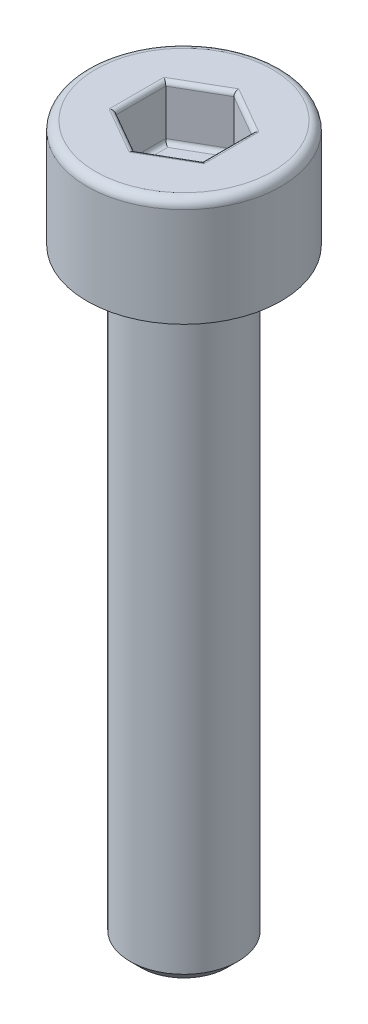
from build123d import *

# Parameters (mm, degrees)
CHAMFER1_SIZE      = 0.25
FILLET1_R          = 0.2
CUT_EXTRUDE1_DEPTH = 1.25
FILLET2_R          = 0.1


with BuildPart() as part:
    # Sketch1 → Revolve1 (revolve)
    with BuildSketch(Plane.XY, mode=Mode.PRIVATE) as revolve1_sk:
        Polygon((0, -16.5), (-1.25, -16.5), (-1.25, -2.5), (-2.25, -2.5), (-2.25, 0), (0, 0), align=None)
    revolve(revolve1_sk.sketch.rotate(Axis((0, 0, 0), (0, -1, 0)), 270), axis=Axis((0, 0, 0), (0, -1, 0)))

    # Chamfer1
    chamfer1_edges = [part.edges().sort_by_distance(p)[0] for p in [
        (0, -2.5, -1.25),
        (0, -16.5, -1.25),
    ]]
    chamfer(chamfer1_edges, length=CHAMFER1_SIZE)

    # Fillet1
    fillet1_edges = [part.edges().sort_by_distance(p)[0] for p in [
        (0, 0, -2.25),
    ]]
    fillet(fillet1_edges, radius=FILLET1_R)

    # Sketch2 → Cut-Extrude1 (cut)
    with BuildSketch(Plane(origin=(0, 0, 0), x_dir=(1, 0, 0), z_dir=(0, 1, 0))):
        Polygon((0, 1.154700538), (-1, 0.577350269), (-1, -0.577350269), (0, -1.154700538), (1, -0.577350269), (1, 0.577350269), align=None)
    extrude(amount=-CUT_EXTRUDE1_DEPTH, mode=Mode.SUBTRACT)

    # Fillet2
    fillet2_edges = [part.edges().sort_by_distance(p)[0] for p in [
        (0.5, -1.25, -0.866025404),
        (1, -1.25, 0),
        (0.5, -1.25, 0.866025404),
        (-0.5, -1.25, 0.866025404),
        (-1, -1.25, 0),
        (-0.5, -1.25, -0.866025404),
        (0.4999999999999987, 0, -0.8660254037844397),
        (-0.5000000000000006, 0, -0.8660254037844395),
        (-1, 0, 0),
        (-0.5000000000000007, 0, 0.8660254037844379),
        (0.4999999999999988, 0, 0.8660254037844382),
        (1, 0, 0),
    ]]
    fillet(fillet2_edges, radius=FILLET2_R)


solid = part.part
